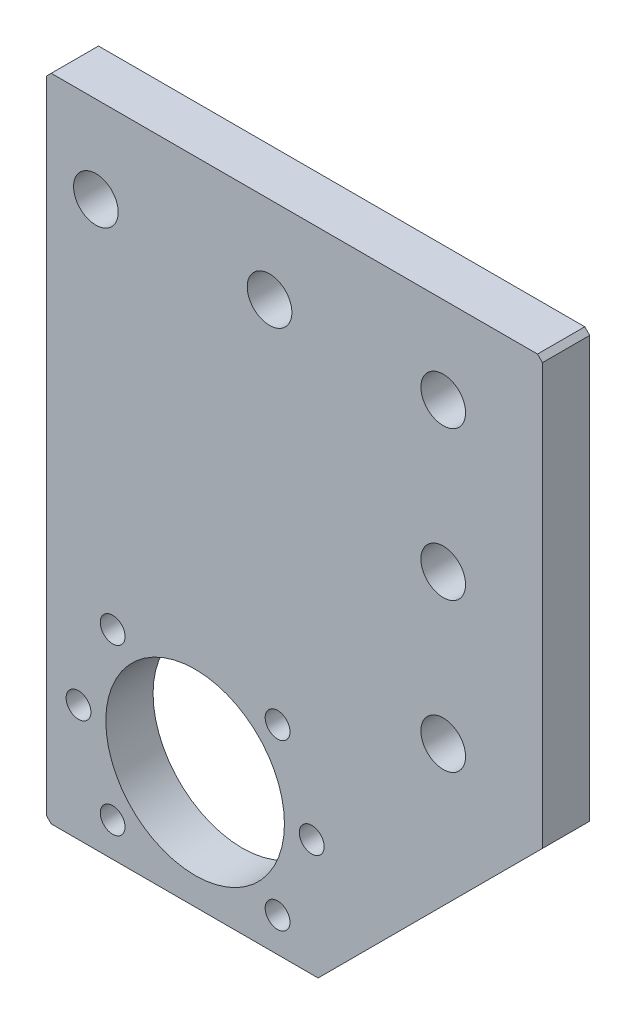
from build123d import *

# Parameters (mm, degrees)
SKETCH1_R             = 18
BOSS_EXTRUDE1_DEPTH   = 4.7625
M8_CLEARANCE_HOLE1_D  = 9
M6X1_0_TAPPED_HOLE1_D = 5
CHAMFER1_SIZE         = 1


with BuildPart() as part:
    # Sketch1 → Boss-Extrude1 (new, symmetric)
    with BuildSketch(Plane.XY):
        Polygon((-30, -23.5), (24.784271247, -23.5), (70, 21.715728753), (70, 107.5), (-30, 107.5), align=None)
        with Locations(Location((0, 0, 0), (0, 0, 180))):
            Circle(SKETCH1_R, mode=Mode.SUBTRACT)
    extrude(amount=BOSS_EXTRUDE1_DEPTH, both=True)

    # M8 Clearance Hole1 (through all)
    with Locations(Plane.XY.offset(4.7625)):
        with Locations((-20, 90), (15, 90), (50, 90), (50, 60), (50, 30)):
            Hole(M8_CLEARANCE_HOLE1_D / 2)

    # M6x1.0 Tapped Hole1 (through all)
    with Locations(Plane.XY.offset(4.7625)):
        with Locations((16.617009358, 16.617009358), (23.5, 0), (16.617009358, -16.617009358), (-16.617009358, -16.617009358), (-23.5, 0), (-16.617009358, 16.617009358)):
            Hole(M6X1_0_TAPPED_HOLE1_D / 2)

    # Chamfer1
    chamfer1_edges = [part.edges().sort_by_distance(p)[0] for p in [
        (-30, 107.5, 0),
        (70, 107.5, 0),
        (-30, -23.5, 0),
    ]]
    chamfer(chamfer1_edges, length=CHAMFER1_SIZE)


solid = part.part
